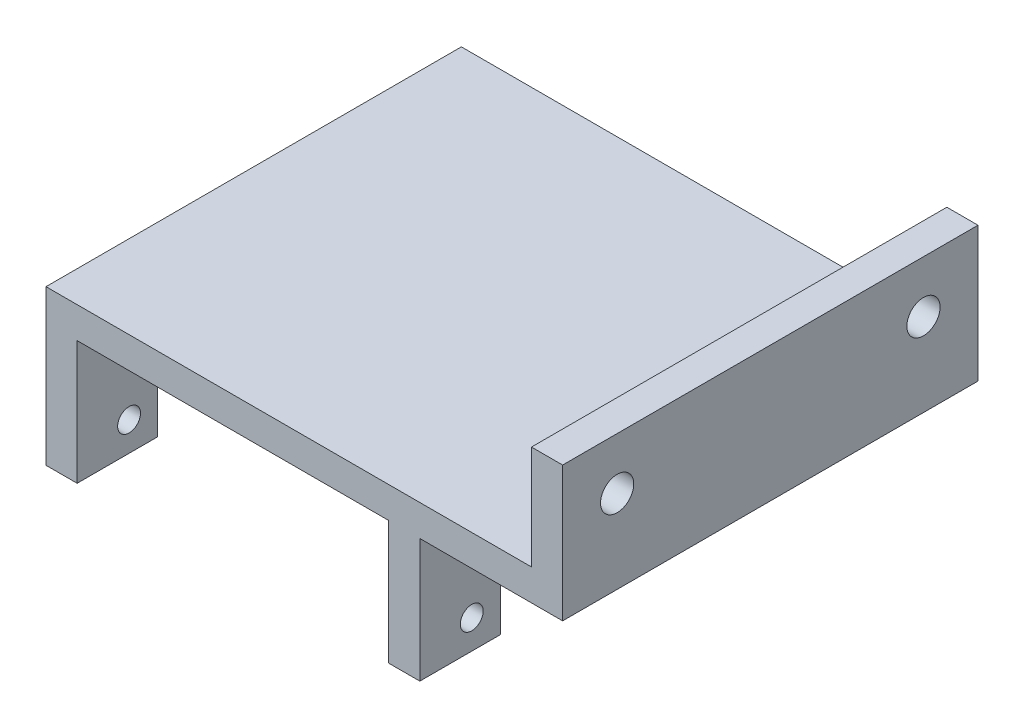
from build123d import *

# Parameters (mm, degrees)
SKETCH2_W           = 49.75
SKETCH2_H           = 40
BOSS_EXTRUDE1_DEPTH = 3
SKETCH2_4_W         = 3
SKETCH2_4_H         = 40
BOSS_EXTRUDE3_DEPTH = 11.9
SKETCH2_5_W         = 3
SKETCH2_5_H         = 40
BOSS_EXTRUDE4_DEPTH = 13
CUT_EXTRUDE1_REACH  = 57.173
SKETCH3_R           = 1.1
SKETCH3_W           = 24.5
SKETCH3_H           = 6.4
SKETCH4_R           = 1.6
CUT_EXTRUDE2_DEPTH  = 3


with BuildPart() as part:
    # Sketch2 → Boss-Extrude1 (new body)
    with BuildSketch(Plane(origin=(0, 0, 0), x_dir=(1, 0, 0), z_dir=(0, 1, 0))):
        Rectangle(SKETCH2_W, SKETCH2_H)
    extrude(amount=BOSS_EXTRUDE1_DEPTH)

    # Sketch2<4> → Boss-Extrude3 (add)
    with BuildSketch(Plane(origin=(0, 0, 0), x_dir=(1, 0, 0), z_dir=(0, 1, 0))):
        with Locations((9.625, 0)):
            Rectangle(SKETCH2_4_W, SKETCH2_4_H)
        with Locations((-23.375, 0)):
            Rectangle(SKETCH2_4_W, SKETCH2_4_H)
    extrude(amount=-BOSS_EXTRUDE3_DEPTH)

    # Sketch2<5> → Boss-Extrude4 (add)
    with BuildSketch(Plane(origin=(0, 0, 0), x_dir=(1, 0, 0), z_dir=(0, 1, 0))):
        with Locations((23.375, 0)):
            Rectangle(SKETCH2_5_W, SKETCH2_5_H)
    extrude(amount=BOSS_EXTRUDE4_DEPTH)

    # Cut-Extrude1: up to this face of the body (flat: up to its plane)
    cut_extrude1_end = Plane(part.part.faces().sort_by_distance((11.125, -5.95, 0))[0])
    # Sketch3 → Cut-Extrude1 (cut, up to the picked face)
    with BuildSketch(Plane.ZY.offset(24.875), mode=Mode.PRIVATE) as cut_extrude1_sk1:
        with Locations((-8.5, -2.8)):
            Circle(SKETCH3_R)
    cut_extrude1_tool1 = split(extrude(cut_extrude1_sk1.sketch, amount=-CUT_EXTRUDE1_REACH, mode=Mode.PRIVATE), bisect_by=cut_extrude1_end, keep=Keep.BOTH, mode=Mode.PRIVATE)
    # Sketch3 → Cut-Extrude1 (cut, up to the picked face)
    with BuildSketch(Plane.ZY.offset(24.875), mode=Mode.PRIVATE) as cut_extrude1_sk2:
        with Locations((-15, -9.1)):
            Circle(SKETCH3_R)
    cut_extrude1_tool2 = split(extrude(cut_extrude1_sk2.sketch, amount=-CUT_EXTRUDE1_REACH, mode=Mode.PRIVATE), bisect_by=cut_extrude1_end, keep=Keep.BOTH, mode=Mode.PRIVATE)
    # Sketch3 → Cut-Extrude1 (cut, up to the picked face)
    with BuildSketch(Plane.ZY.offset(24.875), mode=Mode.PRIVATE) as cut_extrude1_sk3:
        with Locations((0, -8.7)):
            Rectangle(SKETCH3_W, SKETCH3_H)
    cut_extrude1_tool3 = split(extrude(cut_extrude1_sk3.sketch, amount=-CUT_EXTRUDE1_REACH, mode=Mode.PRIVATE), bisect_by=cut_extrude1_end, keep=Keep.BOTH, mode=Mode.PRIVATE)
    cut_extrude1_1 = cut_extrude1_tool1.solids().sort_by(Axis((-24.875, -2.8, -8.5), (1, 0, 0)))[0]
    add(cut_extrude1_1, mode=Mode.SUBTRACT)
    cut_extrude1_2 = cut_extrude1_tool2.solids().sort_by(Axis((-24.875, -9.1, -15), (1, 0, 0)))[0]
    add(cut_extrude1_2, mode=Mode.SUBTRACT)
    cut_extrude1_3 = cut_extrude1_tool3.solids().sort_by(Axis((-24.875, -8.7, 0), (1, 0, 0)))[0]
    add(cut_extrude1_3, mode=Mode.SUBTRACT)
    cut_extrude1 = cut_extrude1_1 + cut_extrude1_2 + cut_extrude1_3  # Cut-Extrude1 as one shape, for the pattern or mirror that repeats it

    # Sketch4 → Cut-Extrude2 (cut)
    with BuildSketch(Plane.ZY.offset(-21.875)):
        with Locations((-14.75, 8)):
            Circle(SKETCH4_R)
    cut_extrude2 = extrude(amount=-CUT_EXTRUDE2_DEPTH, mode=Mode.SUBTRACT)

    # Mirror2: Cut-Extrude1, Cut-Extrude2 across plane
    add(cut_extrude1.mirror(Plane.XY), mode=Mode.SUBTRACT)
    add(cut_extrude2.mirror(Plane.XY), mode=Mode.SUBTRACT)


solid = part.part
